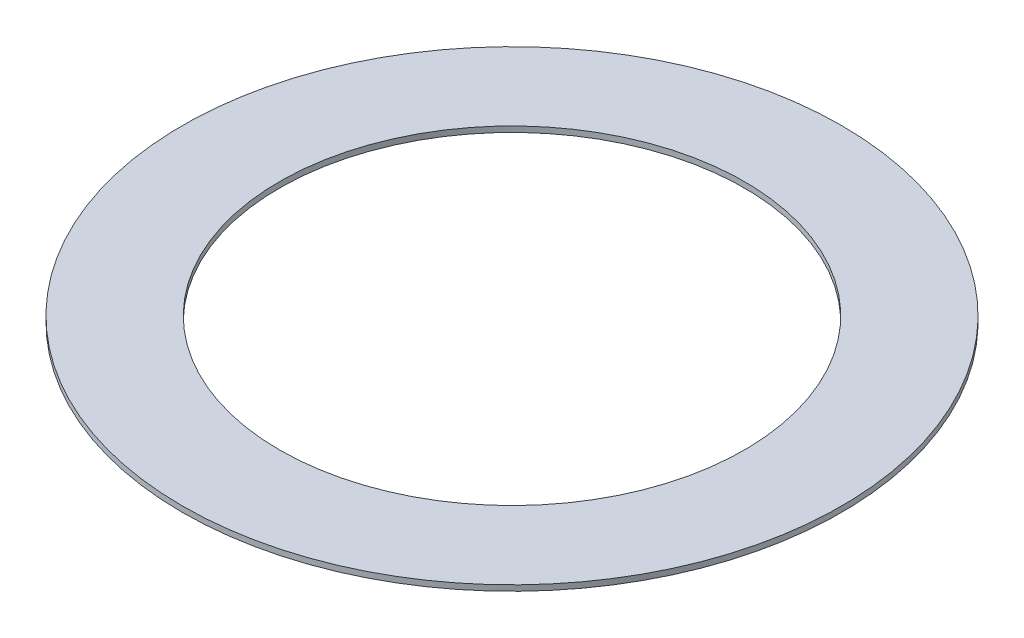
from build123d import *

# Parameters (mm, degrees)
SKETCH1_R           = 175.920811822
SKETCH1_R_2         = 124.091997973
BOSS_EXTRUDE1_DEPTH = 3


with BuildPart() as part:
    # Sketch1 → Boss-Extrude1 (new body)
    with BuildSketch(Plane(origin=(0, 0, 0), x_dir=(1, 0, 0), z_dir=(0, 1, 0))):
        with Locations(Location((0, 0, 0), (0, 0, 270))):
            Circle(SKETCH1_R)
        with Locations(Location((0, 0, 0), (0, 0, 270))):
            Circle(SKETCH1_R_2, mode=Mode.SUBTRACT)
    extrude(amount=BOSS_EXTRUDE1_DEPTH)


solid = part.part
